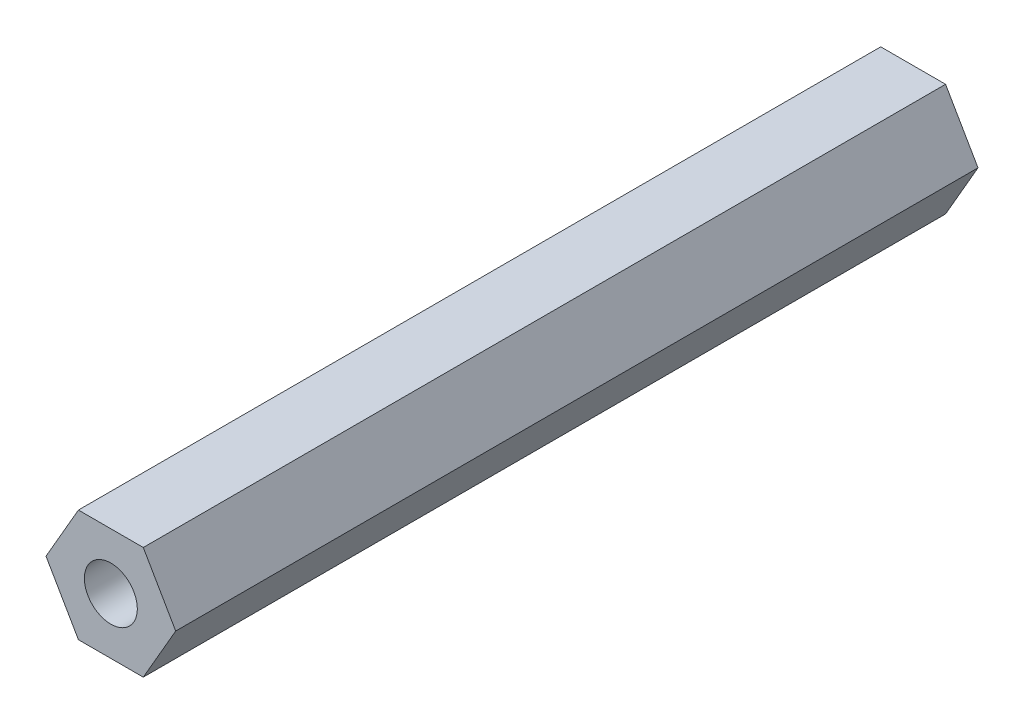
from build123d import *

# Parameters (mm, degrees)
BOSS_EXTRU_1_DEPTH      = 50
ESQUISSE2_R             = 1.65
ENL_V_MAT_EXTRU_1_DEPTH = 9
ENL_V_START             = -41
ESQUISSE2_2_R           = 1.65
ENL_V_MAT_EXTRU_2_DEPTH = 9


with BuildPart() as part:
    # Esquisse1 → Boss.-Extru.1 (new body)
    with BuildSketch(Plane.XY):
        Polygon((4.041451884, 0), (2.020725942, 3.5), (-2.020725942, 3.5), (-4.041451884, 0), (-2.020725942, -3.5), (2.020725942, -3.5), align=None)
    extrude(amount=BOSS_EXTRU_1_DEPTH)

    # Esquisse2 → Enlèv. mat.-Extru.1 (cut)
    with BuildSketch(Plane.XY.offset(50)):
        Circle(ESQUISSE2_R)
    extrude(amount=-ENL_V_MAT_EXTRU_1_DEPTH, mode=Mode.SUBTRACT)

    # Esquisse2<2> → Enlèv. mat.-Extru.2 (cut)
    with BuildSketch(Plane.XY.offset(50).offset(ENL_V_START)):
        Circle(ESQUISSE2_2_R)
    extrude(amount=-ENL_V_MAT_EXTRU_2_DEPTH, mode=Mode.SUBTRACT)


solid = part.part
